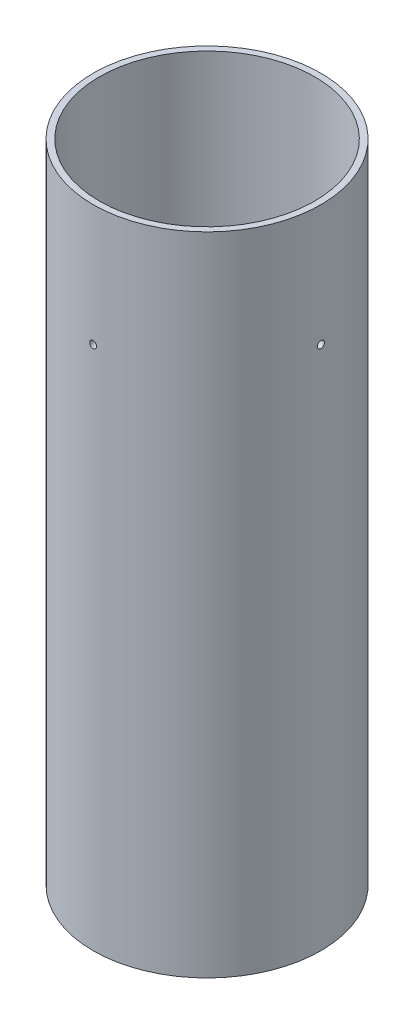
from build123d import *

# Parameters (mm, degrees)
SKETCH1_R               = 53.721
SKETCH1_R_2             = 50.8
TUBE_EXTRUSION_DEPTH    = 304.8
CUT_EXTRUDE1_REACH      = 329.617
CUT_EXTRUDE1_END_RADIUS = 50.8
SKETCH2_R               = 1.6383
CIRPATTERN1_COUNT       = 4


with BuildPart() as part:
    # Sketch1 → Tube Extrusion (new body)
    with BuildSketch(Plane(origin=(0, 0, 0), x_dir=(1, 0, 0), z_dir=(0, 1, 0))):
        with Locations(Location((0, 0, 0), (0, 0, 90))):
            Circle(SKETCH1_R)
        with Locations(Location((0, 0, 0), (0, 0, 90))):
            Circle(SKETCH1_R_2, mode=Mode.SUBTRACT)
    extrude(amount=TUBE_EXTRUSION_DEPTH)

    # Cut-Extrude1: up to this cylinder (the profile starts outside it)
    cut_extrude1_end = Plane(origin=(0, 247.65, 0), z_dir=(0, -1, 0)) * Cylinder(CUT_EXTRUDE1_END_RADIUS, 761.834, mode=Mode.PRIVATE)
    # Sketch2 → Cut-Extrude1 (cut, up to the surface)
    with BuildSketch(Plane(origin=(53.721, 0, 0), x_dir=(0, 0, -1), z_dir=(1, 0, 0)), mode=Mode.PRIVATE) as cut_extrude1_sk1:
        with Locations((0, 247.65)):
            Circle(SKETCH2_R)
    cut_extrude1_tool1 = extrude(cut_extrude1_sk1.sketch, amount=-CUT_EXTRUDE1_REACH, mode=Mode.PRIVATE) - cut_extrude1_end
    cut_extrude1 = cut_extrude1_tool1.solids().sort_by_distance((53.721, 247.65, 0))[0]
    add(cut_extrude1, mode=Mode.SUBTRACT)

    # CirPattern1: Cut-Extrude1 ×4 about axis
    cirpattern1_axis = Axis((0, 304.8, 0), (0, -1, 0))
    for i in range(1, CIRPATTERN1_COUNT):
        add(cut_extrude1.rotate(cirpattern1_axis, i * 360 / CIRPATTERN1_COUNT), mode=Mode.SUBTRACT)


solid = part.part
